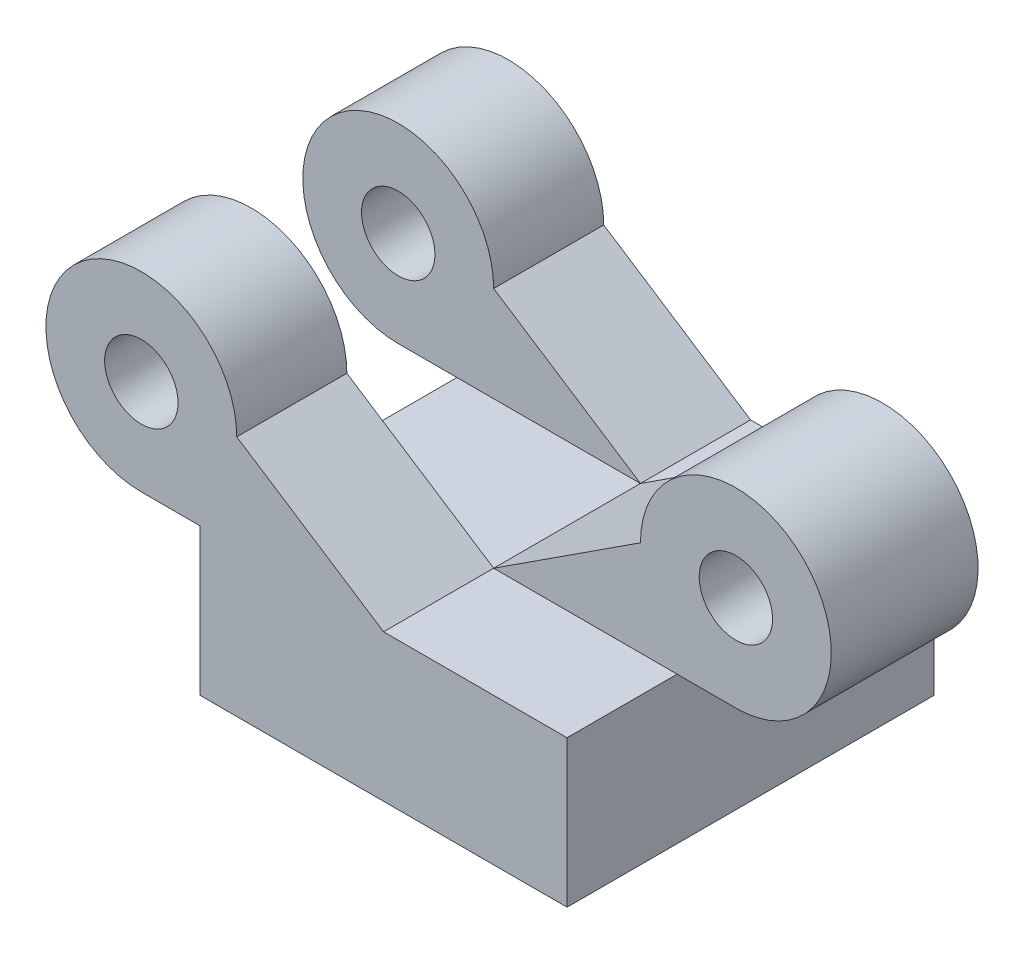
from build123d import *

# Parameters (mm, degrees)
SKETCH1_W                = 25
SKETCH1_H                = 25
BOSS_EXTRUDE1_DEPTH      = 10
BOSS_EXTRUDE2_DEPTH      = 12.5
BOSS_EXTRUDE2_DEPTH_BACK = 12.5
SKETCH2_R                = 2.5
SKETCH3_W                = 25.519828657
SKETCH3_H                = 10
SKETCH3_W_2              = 24.900390406
SKETCH3_H_2              = 9.385874126
SKETCH3_H_3              = 11.424636542
CUT_EXTRUDE1_DEPTH       = 22.5


with BuildPart() as part:
    # Sketch1 → Boss-Extrude1 (new body)
    with BuildSketch(Plane(origin=(0, 0, 0), x_dir=(1, 0, 0), z_dir=(0, 1, 0))):
        Rectangle(SKETCH1_W, SKETCH1_H)
    extrude(amount=-BOSS_EXTRUDE1_DEPTH)

    # Sketch2 → Boss-Extrude2 (add, two sides: drawn at the far end of the back side and taken through both)
    # profile 1 of 2: a face of its own
    with BuildSketch(Plane.XY.offset(-BOSS_EXTRUDE2_DEPTH_BACK)):
        with BuildLine():
            Line((0, 0), (-10, 6.5))
            ThreePointArc((-10, 6.5), (-21.096194078, 11.096194078), (-16.5, 0))
            Line((-16.5, 0), (0, 0))
        make_face()
        with Locations((-16.5, 6.5)):
            Circle(SKETCH2_R, mode=Mode.SUBTRACT)
    # profile 2 of 2: a face of its own
    with BuildSketch(Plane.XY.offset(-BOSS_EXTRUDE2_DEPTH_BACK)):
        with BuildLine():
            Line((10, 6.5), (0, 0))
            Line((0, 0), (16.5, 0))
            ThreePointArc((16.5, 0), (21.096194078, 11.096194078), (10, 6.5))
        make_face()
        with Locations((16.5, 6.5)):
            Circle(SKETCH2_R, mode=Mode.SUBTRACT)
    extrude(amount=BOSS_EXTRUDE2_DEPTH + BOSS_EXTRUDE2_DEPTH_BACK)

    # Sketch3 → Cut-Extrude1 (cut)
    with BuildSketch(Plane(origin=(0, 0, 0), x_dir=(1, 0, 0), z_dir=(0, 1, 0))):
        with Locations((-12.759914329, 0)):
            Rectangle(SKETCH3_W, SKETCH3_H)
        with Locations((12.450195203, -9.692937063)):
            Rectangle(SKETCH3_W_2, SKETCH3_H_2)
        with Locations((12.450195203, 10.712318271)):
            Rectangle(SKETCH3_W_2, SKETCH3_H_3)
    extrude(amount=CUT_EXTRUDE1_DEPTH, mode=Mode.SUBTRACT)


solid = part.part
